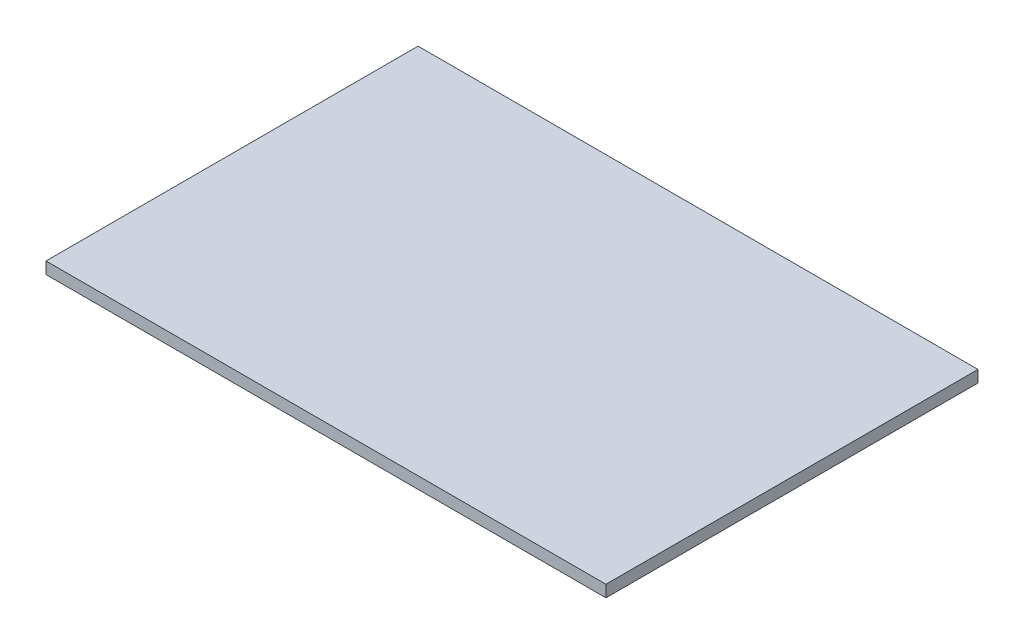
from build123d import *

# Parameters (mm, degrees)
SKETCH5_W           = 76
SKETCH5_H           = 50.5
BOSS_EXTRUDE1_DEPTH = 1.6


with BuildPart() as part:
    # Sketch5 → Boss-Extrude1 (new body)
    with BuildSketch(Plane(origin=(0, 0, 0), x_dir=(1, 0, 0), z_dir=(0, 1, 0))):
        Rectangle(SKETCH5_W, SKETCH5_H)
    extrude(amount=BOSS_EXTRUDE1_DEPTH)


solid = part.part
